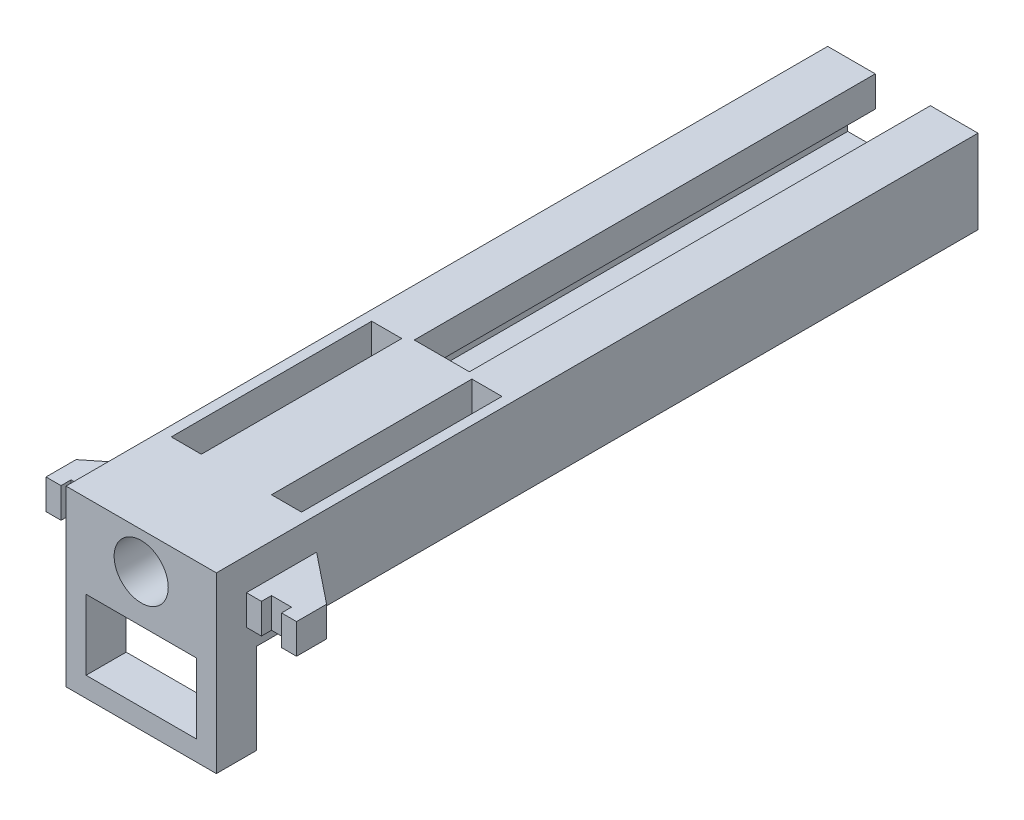
from build123d import *

# Parameters (mm, degrees)
SKETCH9_W               = 15
SKETCH9_H               = 8.35
BOSS_EXTRUDE4_DEPTH     = 76
CUT_EXTRUDE4_DEPTH      = 46
SKETCH10_R              = 2.7
CUT_EXTRUDE5_DEPTH      = 30
SKETCH12_W              = 3
SKETCH12_H              = 3
BOSS_EXTRUDE5_DEPTH     = 5
SKETCH13_W              = 2
SKETCH13_H              = 3
CUT_EXTRUDE6_DEPTH      = 1
BOSS_EXTRUDE6_DEPTH     = 3
CUT_EXTRUDE7_REACH      = 79.472
SKETCH15_W              = 3
SKETCH15_H              = 20
CUT_EXTRUDE8_REACH      = 79.472
CUT_EXTRUDE8_END_RADIUS = 2.7
SKETCH16_R              = 2.5
BOSS_EXTRUDE8_DEPTH     = 4


with BuildPart() as part:
    # Sketch9 → Boss-Extrude4 (new body)
    with BuildSketch(Plane.XY):
        with Locations((0, 4.175)):
            Rectangle(SKETCH9_W, SKETCH9_H)
    extrude(amount=BOSS_EXTRUDE4_DEPTH)

    # Sketch7 → Cut-Extrude4 (cut)
    with BuildSketch(Plane.XY):
        Polygon((-5.5, 2), (-5.5, 5.3), (-2.75, 5.3), (-2.75, 8.35), (2.75, 8.35), (2.75, 5.3), (5.5, 5.3), (5.5, 2), align=None)
    extrude(amount=CUT_EXTRUDE4_DEPTH, mode=Mode.SUBTRACT)

    # Sketch10 → Cut-Extrude5 (cut)
    with BuildSketch(Plane.XY.offset(76)):
        with Locations((0, 4.7)):
            Circle(SKETCH10_R)
    extrude(amount=-CUT_EXTRUDE5_DEPTH, mode=Mode.SUBTRACT)

    # Sketch12 → Boss-Extrude5 (add)
    with BuildSketch(Plane(origin=(7.5, 0, 0), x_dir=(0, 0, -1), z_dir=(1, 0, 0))):
        with Locations((-71.5, 3.64)):
            Rectangle(SKETCH12_W, SKETCH12_H)
    boss_extrude5 = extrude(amount=BOSS_EXTRUDE5_DEPTH)

    # Sketch13 → Cut-Extrude6 (cut)
    with BuildSketch(Plane.XY.offset(73)):
        with Locations((10, 3.64)):
            Rectangle(SKETCH13_W, SKETCH13_H)
    cut_extrude6 = extrude(amount=-CUT_EXTRUDE6_DEPTH, mode=Mode.SUBTRACT)

    # Mirror2: Boss-Extrude5 across plane
    add(boss_extrude5.mirror(Plane(origin=(0, 0, 0), x_dir=(0, 0, 1), z_dir=(1, 0, 0))))

    # Mirror4: Cut-Extrude6 across plane
    add(cut_extrude6.mirror(Plane(origin=(0, 0, 0), x_dir=(0, 0, 1), z_dir=(1, 0, 0))), mode=Mode.SUBTRACT)

    # Sketch14 → Boss-Extrude6 (add)
    with BuildSketch(Plane(origin=(0, 5.14, 0), x_dir=(1, 0, 0), z_dir=(0, 1, 0))):
        Polygon((12.5, -70), (7.5, -66), (7.5, -70), align=None)
    boss_extrude6 = extrude(amount=-BOSS_EXTRUDE6_DEPTH)

    # Mirror5: Boss-Extrude6 across plane
    add(boss_extrude6.mirror(Plane(origin=(0, 0, 0), x_dir=(0, 0, 1), z_dir=(1, 0, 0))))

    # Sketch15 → Cut-Extrude7 (cut, up to next)
    with BuildSketch(Plane(origin=(0, 8.35, 0), x_dir=(1, 0, 0), z_dir=(0, 1, 0)), mode=Mode.PRIVATE) as cut_extrude7_sk1:
        with Locations((-5, -56.5)):
            Rectangle(SKETCH15_W, SKETCH15_H)
    cut_extrude7_tool1 = extrude(cut_extrude7_sk1.sketch, amount=-CUT_EXTRUDE7_REACH, mode=Mode.PRIVATE) & part.part
    cut_extrude7 = cut_extrude7_tool1.solids().sort_by_distance((-5, 8.35, 56.5))[0]
    add(cut_extrude7, mode=Mode.SUBTRACT)

    # Mirror6: Cut-Extrude7 across plane
    add(cut_extrude7.mirror(Plane(origin=(0, 0, 0), x_dir=(0, 0, 1), z_dir=(1, 0, 0))), mode=Mode.SUBTRACT)

    # Cut-Extrude8: up to this cylinder (the profile starts outside it)
    cut_extrude8_end = Plane(origin=(0, 4.7, 69), z_dir=(0, 0, 1)) * Cylinder(CUT_EXTRUDE8_END_RADIUS, 165.344, mode=Mode.PRIVATE)
    # Sketch16 → Cut-Extrude8 (cut, up to the surface)
    with BuildSketch(Plane.XZ, mode=Mode.PRIVATE) as cut_extrude8_sk1:
        with Locations(Location((0, 69, 0), (0, 0, 270))):
            Circle(SKETCH16_R)
    cut_extrude8_tool1 = extrude(cut_extrude8_sk1.sketch, amount=-CUT_EXTRUDE8_REACH, mode=Mode.PRIVATE) - cut_extrude8_end
    add(cut_extrude8_tool1.solids().sort_by_distance((0, 0, 69))[0], mode=Mode.SUBTRACT)

    # Sketch18 → Boss-Extrude8 (add)
    with BuildSketch(Plane.XY.offset(76)):
        Polygon((-5.5, 0), (-7.5, 0), (-7.5, -9), (7.5, -9), (7.5, 0), (5.5, 0), (5.5, -7), (-5.5, -7), align=None)
    extrude(amount=-BOSS_EXTRUDE8_DEPTH)


solid = part.part
